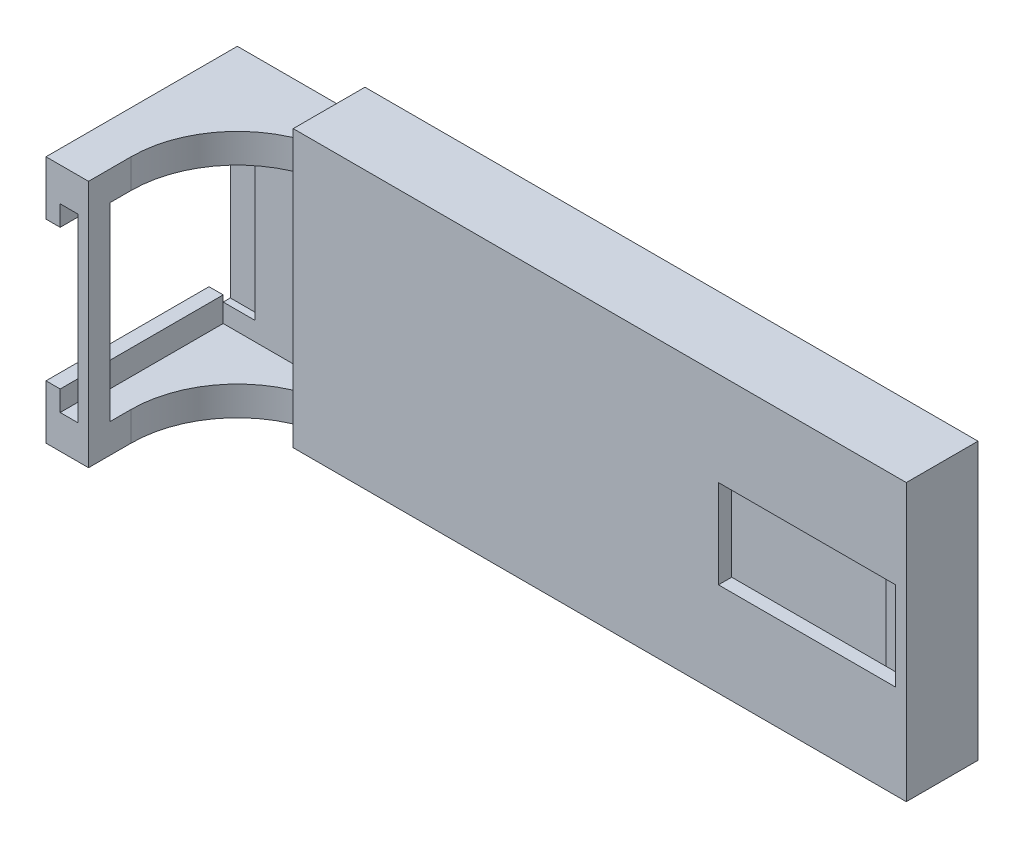
from build123d import *

# Parameters (mm, degrees)
SKETCH1_W            = 85
SKETCH1_H            = 35
BOSS_EXTRUDE1_DEPTH  = 2
BOSS_EXTRUDE2_DEPTH  = 2
BOSS_EXTRUDE3_DEPTH  = 2
BOSS_EXTRUDE4_DEPTH  = 85
SKETCH6_W            = 10.11797479
SKETCH6_H            = 39
BOSS_EXTRUDE5_DEPTH  = 1.5
BOSS_EXTRUDE6_DEPTH  = 10
SKETCH8_W            = 18
SKETCH8_H            = 4.125
SKETCH8_W_2          = 3
SKETCH8_H_2          = 26.75
BOSS_EXTRUDE7_DEPTH  = 1.5
BOSS_EXTRUDE8_DEPTH  = 2.5
BOSS_EXTRUDE9_DEPTH  = 2
FILLET2_R            = 15
SKETCH11_W           = 60
SKETCH11_H           = 39
BOSS_EXTRUDE10_DEPTH = 1.86797479


with BuildPart() as part:
    # Sketch1 → Boss-Extrude1 (new body)
    with BuildSketch(Plane.XY):
        with Locations((42.5, 17.5)):
            Rectangle(SKETCH1_W, SKETCH1_H)
    extrude(amount=BOSS_EXTRUDE1_DEPTH)

    # Sketch2 → Boss-Extrude2 (add)
    with BuildSketch(Plane.XY.offset(2)):
        Polygon((83, 2.125), (0, 2.125), (0, 0), (85, 0), (85, 35), (0, 35), (0, 32.875), (83, 32.875), align=None)
    extrude(amount=BOSS_EXTRUDE2_DEPTH)

    # Sketch3 → Boss-Extrude3 (add)
    with BuildSketch(Plane.XY.offset(4)):
        Polygon((0, 4.125), (0, 2.125), (83, 2.125), (83, 32.875), (0, 32.875), (0, 30.875), (81.5, 30.875), (81.5, 4.125), align=None)
        Polygon((0, 32.875), (83, 32.875), (83, 2.125), (0, 2.125), (0, 0), (85, 0), (85, 35), (0, 35), align=None)
    extrude(amount=BOSS_EXTRUDE3_DEPTH)

    # Sketch7 → Boss-Extrude6 (add)
    with BuildSketch(Plane.ZY):
        Polygon((0, 35), (6, 35), (6, 30.875), (4, 30.875), (4, 32.875), (2, 32.875), (2, 2.125), (4, 2.125), (4, 4.125), (6, 4.125), (6, 0), (0, 0), align=None)
    extrude(amount=BOSS_EXTRUDE6_DEPTH)

    # Sketch8 → Boss-Extrude7 (add)
    with BuildSketch(Plane.ZY.offset(10)):
        Polygon((6, 35), (0, 35), (0, 0), (6, 0), (6, 4.125), (4, 4.125), (4, 2.125), (2, 2.125), (2, 32.875), (4, 32.875), (4, 30.875), (6, 30.875), align=None)
        with Locations((15, 32.9375)):
            Rectangle(SKETCH8_W, SKETCH8_H)
        with Locations((15, 2.0625)):
            Rectangle(SKETCH8_W, SKETCH8_H)
        with Locations((25.5, 2.0625)):
            Rectangle(SKETCH8_W_2, SKETCH8_H)
        with Locations((25.5, 17.5)):
            Rectangle(SKETCH8_W_2, SKETCH8_H_2)
        with Locations((25.5, 32.9375)):
            Rectangle(SKETCH8_W_2, SKETCH8_H)
    extrude(amount=BOSS_EXTRUDE7_DEPTH)

    # Sketch9 → Boss-Extrude8 (add)
    with BuildSketch(Plane.ZY.offset(11.5)):
        Polygon((24, 30.25), (27, 30.25), (27, 35), (0, 35), (0, 0), (27, 0), (27, 4.75), (24, 4.75), (24, 4.125), (6, 4.125), (4, 4.125), (4, 2.125), (2, 2.125), (2, 4.75), (1, 4.75), (1, 30.25), (2, 30.25), (2, 32.875), (4, 32.875), (4, 30.875), (6, 30.875), (24, 30.875), align=None)
    extrude(amount=BOSS_EXTRUDE8_DEPTH)

    # Sketch10 → Boss-Extrude9 (add)
    with BuildSketch(Plane.ZY.offset(14)):
        Polygon((27, 35), (4, 35), (4, 32.875), (4, 30.875), (24, 30.875), (24, 30.25), (27, 30.25), align=None)
        Polygon((27, 27.375), (27, 30.25), (24, 30.25), (24, 30.875), (4, 30.875), (4, 27.375), align=None)
        Polygon((4, 35), (0, 35), (0, 0), (4, 0), (4, 2.125), (2, 2.125), (2, 4.75), (1, 4.75), (1, 30.25), (2, 30.25), (2, 32.875), (4, 32.875), align=None)
        Polygon((4, 2.125), (4, 0), (27, 0), (27, 4.75), (24, 4.75), (24, 4.125), (4, 4.125), align=None)
        Polygon((24, 4.75), (27, 4.75), (27, 7.625), (4, 7.625), (4, 4.125), (24, 4.125), align=None)
    extrude(amount=BOSS_EXTRUDE9_DEPTH)

    # Fillet2
    fillet2_edges = [part.edges().sort_by_distance(p)[0] for p in [
        (-10, 2.0625, 6),
        (-10, 32.9375, 6),
    ]]
    fillet(fillet2_edges, radius=FILLET2_R)


with BuildPart() as body_2:
    # Sketch5 → Boss-Extrude4 (new body)
    with BuildSketch(Plane(origin=(85, 0, 0), x_dir=(0, 0, -1), z_dir=(1, 0, 0))):
        Polygon((2, -2), (2, 37), (-8.11797479, 37), (-8.11797479, 23.75), (-6.25, 23.75), (-6.25, 35.25), (0.25, 35.25), (0.25, -0.25), (-6.25, -0.25), (-6.25, 11.25), (-8.11797479, 11.25), (-8.11797479, -2), align=None)
    extrude(amount=-BOSS_EXTRUDE4_DEPTH)

    # Sketch6 → Boss-Extrude5 (add)
    with BuildSketch(Plane(origin=(85, 0, 0), x_dir=(0, 0, -1), z_dir=(1, 0, 0))):
        with Locations((-3.058987395, 17.5)):
            Rectangle(SKETCH6_W, SKETCH6_H)
    extrude(amount=BOSS_EXTRUDE5_DEPTH)

    # Sketch11 → Boss-Extrude10 (add)
    with BuildSketch(Plane.XY.offset(8.11797479)):
        with Locations((30, 17.5)):
            Rectangle(SKETCH11_W, SKETCH11_H)
    extrude(amount=-BOSS_EXTRUDE10_DEPTH)


solid = Compound([part.part, body_2.part])
